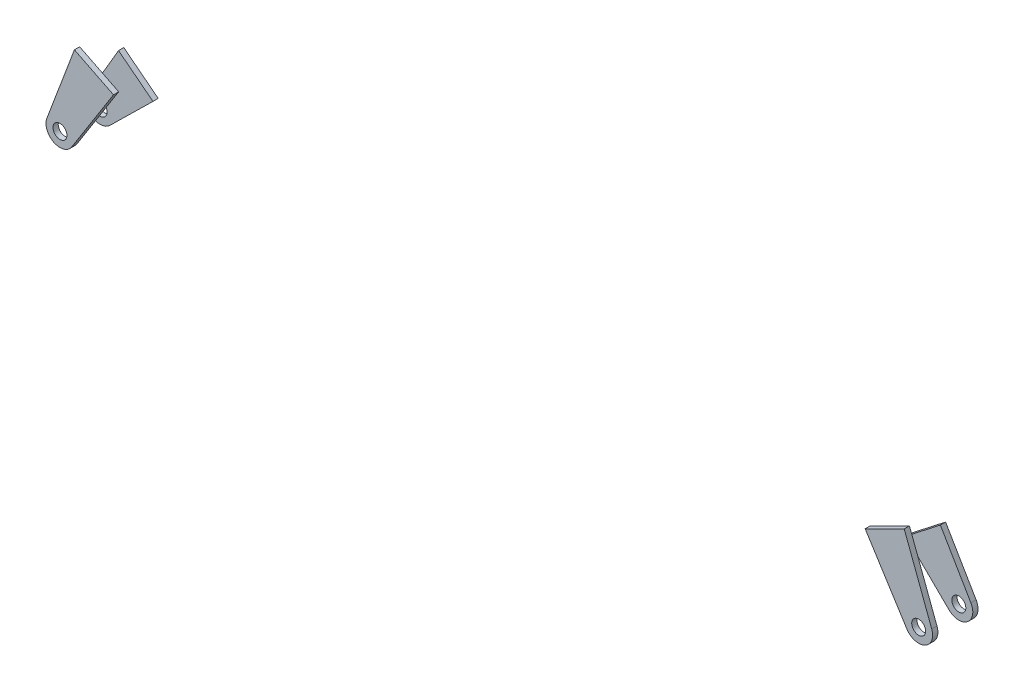
from build123d import *

# Parameters (mm, degrees)
F_3DSKETCH1_R        = 4
BOSS_EXTRUDE_U_DEPTH = 3
BOSS_EXTRUDE_L_START = -3
F_3DSKETCH2_R        = 4
BOSS_EXTRUDE_L_DEPTH = 3


with BuildPart() as part:
    # 3DSketch1 → Boss-Extrude-U (new body)
    with BuildSketch(Plane(origin=(239.239864032, -2205.277915578, 232), x_dir=(-0.031234182001520523, 0.9995120939111722, 0), z_dir=(0, 0, 1))):
        with BuildLine():
            Line((0, 0), (38.500980332, 22.711737925))
            Line((38.500980332, 22.711737925), (48.94975827, 0))
            Line((48.94975827, 0), (6.652616688, -14.460302212))
            ThreePointArc((6.652616688, -14.460302212), (-3.203075097, -10.234063791), (0, 0))
        make_face()
        with Locations(Location((4.064681039, -6.890454851, 0), (0, 0, 268.210122088))):
            Circle(F_3DSKETCH1_R, mode=Mode.SUBTRACT)
    extrude(amount=BOSS_EXTRUDE_U_DEPTH)


with BuildPart() as body_2:
    # 3DSketch2 → Boss-Extrude-L (new body)
    with BuildSketch(Plane(origin=(240.394747323, -2206.707989351, 212), x_dir=(-0.12435355031356123, 0.9922379727285248, 3.198635891212861e-14), z_dir=(0, 0, 1)).offset(BOSS_EXTRUDE_L_START)):
        with BuildLine():
            Line((0, 0), (27.119996267, 21.477223018))
            Line((27.119996267, 21.477223018), (39.915655353, 0))
            Line((39.915655353, 0), (8.117448119, -13.624952215))
            ThreePointArc((8.117448119, -13.624952215), (-1.906060655, -10.366164201), (0, 0))
        make_face()
        with Locations(Location((4.966650711, -6.271553293, 0), (0, 0, 262.856574329))):
            Circle(F_3DSKETCH2_R, mode=Mode.SUBTRACT)
    extrude(amount=BOSS_EXTRUDE_L_DEPTH)


with BuildPart() as body_3:
    # Mirror1: mirrored copy
    add(part.part.mirror(Plane(origin=(0, 0, 0), x_dir=(0, 0, 1), z_dir=(1, 0, 0))))


with BuildPart() as body_4:
    # Mirror1 2: mirrored copy
    add(body_2.part.mirror(Plane(origin=(0, 0, 0), x_dir=(0, 0, 1), z_dir=(1, 0, 0))))


solid = Compound([part.part, body_2.part, body_3.part, body_4.part])
